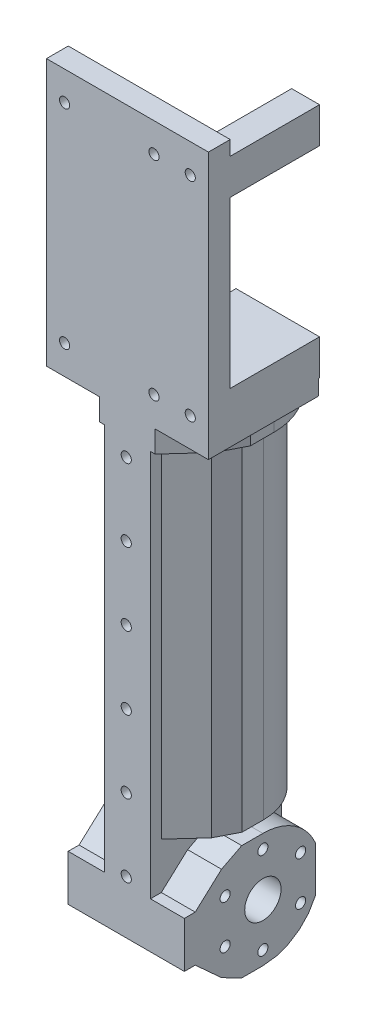
from build123d import *

# Parameters (mm, degrees)
ESQUISSE1_W                  = 22.3
ESQUISSE1_H                  = 36.68
ESQUISSE1_R                  = 0.7
BOSS_EXTRU_1_DEPTH           = 3
ESQUISSE2_W                  = 11.5
ESQUISSE2_H                  = 4.9
BOSS_EXTRU_2_DEPTH           = 12.3
ESQUISSE3_R                  = 0.7
ENL_V_MAT_EXTRU_1_DEPTH      = 46.571947512
BOSS_EXTRU_3_DEPTH           = 2.1
BOSS_EXTRU_4_DEPTH           = 3
BOSS_EXTRU_5_DEPTH           = 47
ESQUISSE9_W                  = 6.330208048
ESQUISSE9_H                  = 18.044681103
BOSS_EXTRU_6_DEPTH           = 19
BOSS_EXTRU_7_DEPTH           = 5
BOSS_EXTRU_7_DEPTH_BACK      = 11
ENL_V_MAT_EXTRU_3_DEPTH      = 73.539666527
ENL_V_MAT_EXTRU_3_DEPTH_BACK = 73.539666527
ESQUISSE13_R                 = 0.7
ENL_V_MAT_EXTRU_4_DEPTH      = 10
ESQUISSE15_R                 = 2.5
ESQUISSE15_R_2               = 0.7
ENL_V_MAT_EXTRU_5_DEPTH      = 73.212855517
ESQUISSE16_W                 = 11.5
ESQUISSE16_H                 = 4.9
BOSS_EXTRU_8_DEPTH           = 12.3
ESQUISSE17_R                 = 0.7
ENL_V_MAT_EXTRU_6_DEPTH      = 74.831939482
ESQUISSE18_W                 = 7.663831116
ESQUISSE18_H                 = 11.431085426
ENL_V_MAT_EXTRU_7_DEPTH      = 6.3


with BuildPart() as part:
    # Esquisse1 → Boss.-Extru.1 (new body)
    with BuildSketch(Plane.XY):
        with Locations((11.15, 18.34)):
            Rectangle(ESQUISSE1_W, ESQUISSE1_H)
        with Locations((19.8, 32.68)):
            Circle(ESQUISSE1_R, mode=Mode.SUBTRACT)
        with Locations(Location((2.5, 32.68, 0), (0, 0, 180))):
            Circle(ESQUISSE1_R, mode=Mode.SUBTRACT)
        with Locations((2.5, 4)):
            Circle(ESQUISSE1_R, mode=Mode.SUBTRACT)
        with Locations(Location((19.8, 4, 0), (0, 0, 180))):
            Circle(ESQUISSE1_R, mode=Mode.SUBTRACT)
        with Locations((14.8, 32.68)):
            Circle(ESQUISSE1_R, mode=Mode.SUBTRACT)
        with Locations(Location((14.8, 4, 0), (0, 0, 180))):
            Circle(ESQUISSE1_R, mode=Mode.SUBTRACT)
    extrude(amount=BOSS_EXTRU_1_DEPTH)

    # Esquisse2 → Boss.-Extru.2 (add)
    with BuildSketch(Plane(origin=(0, 0, 0), x_dir=(-1, 0, 0), z_dir=(0, 0, -1))):
        with Locations((-16.55, 4.55)):
            Rectangle(ESQUISSE2_W, ESQUISSE2_H)
    extrude(amount=BOSS_EXTRU_2_DEPTH)

    # Esquisse3 → Enlèv. mat.-Extru.1 (cut, through all)
    with BuildSketch(Plane.XY.offset(3)):
        with Locations((14.8, 32.68)):
            Circle(ESQUISSE3_R)
        with Locations((19.8, 32.68)):
            Circle(ESQUISSE3_R)
        with Locations(Location((14.8, 4, 0), (0, 0, 180))):
            Circle(ESQUISSE3_R)
        with Locations(Location((19.8, 4, 0), (0, 0, 180))):
            Circle(ESQUISSE3_R)
    extrude(amount=-ENL_V_MAT_EXTRU_1_DEPTH, mode=Mode.SUBTRACT)

    # Esquisse4 → Boss.-Extru.3 (add)
    with BuildSketch(Plane.XZ.offset(-2.1)):
        Polygon((22.3, 0), (10.844911365, 0), (22.3, -12.182112526), align=None)
    extrude(amount=BOSS_EXTRU_3_DEPTH)

    # Esquisse6 → Boss.-Extru.4 (add)
    with BuildSketch(Plane.XZ):
        with BuildLine():
            Line((14.977510411, 3), (7.322489589, 3))
            Line((7.322489589, 3), (3.441219786, -1.258424259))
            Line((3.441219786, -1.258424259), (1.756159604, -4.536943828))
            Line((1.756159604, -4.536943828), (1.756159604, -7.813164477))
            ThreePointArc((1.756159604, -7.813164477), (11.15, -17.207004873), (20.543840396, -7.813164477))
            Line((20.543840396, -7.813164477), (20.543840396, -4.536943828))
            Line((20.543840396, -4.536943828), (18.858780214, -1.258424259))
            Line((18.858780214, -1.258424259), (14.977510411, 3))
        make_face()
    extrude(amount=BOSS_EXTRU_4_DEPTH)

    # Esquisse8 → Boss.-Extru.5 (add)
    with BuildSketch(Plane.XZ.offset(3)):
        with BuildLine():
            Line((7.984895976, 1.5), (4.684165618, -2.12147208))
            Line((4.684165618, -2.12147208), (3.256159604, -4.89985692))
            Line((3.256159604, -4.89985692), (3.256159604, -7.813164477))
            ThreePointArc((3.256159604, -7.813164477), (11.15, -15.707004873), (19.043840396, -7.813164477))
            Line((19.043840396, -7.813164477), (19.043840396, -4.89985692))
            Line((19.043840396, -4.89985692), (17.615834382, -2.12147208))
            Line((17.615834382, -2.12147208), (14.315104024, 1.5))
            Line((14.315104024, 1.5), (14.315104024, 3))
            Line((14.315104024, 3), (7.984895976, 3))
            Line((7.984895976, 3), (7.984895976, 1.5))
        make_face()
    extrude(amount=BOSS_EXTRU_5_DEPTH)

    # Esquisse9 → Boss.-Extru.6 (add)
    with BuildSketch(Plane.XZ.offset(50)):
        with Locations((11.15, -6.022340552)):
            Rectangle(ESQUISSE9_W, ESQUISSE9_H)
    extrude(amount=BOSS_EXTRU_6_DEPTH)

    # Esquisse10 → Boss.-Extru.7 (add, two sides: drawn at the far end of the back side and taken through both)
    with BuildSketch(Plane.ZY.offset(-7.984895976).offset(-BOSS_EXTRU_7_DEPTH_BACK)):
        with BuildLine():
            Line((3, -62.691900244), (3, -56.361692197))
            Line((3, -56.361692197), (1.5, -56.361692197))
            Line((1.5, -56.361692197), (-2.12147208, -53.060961839))
            Line((-2.12147208, -53.060961839), (-4.89985692, -51.632955825))
            Line((-4.89985692, -51.632955825), (-7.813164477, -51.632955825))
            ThreePointArc((-7.813164477, -51.632955825), (-12.133343304, -52.92007456), (-15.044681103, -56.361692197))
            Line((-15.044681103, -56.361692197), (-15.044681103, -62.691900244))
            ThreePointArc((-15.044681103, -62.691900244), (-12.133343304, -66.133517881), (-7.813164477, -67.420636616))
            Line((-7.813164477, -67.420636616), (-4.89985692, -67.420636616))
            Line((-4.89985692, -67.420636616), (-2.12147208, -65.992630602))
            Line((-2.12147208, -65.992630602), (1.5, -62.691900244))
            Line((1.5, -62.691900244), (3, -62.691900244))
        make_face()
    extrude(amount=BOSS_EXTRU_7_DEPTH + BOSS_EXTRU_7_DEPTH_BACK)

    # Esquisse12 → Enlèv. mat.-Extru.3 (cut, two sides: drawn at the far end of the back side and taken through both)
    with BuildSketch(Plane.ZY.offset(-7.984895976).offset(-ENL_V_MAT_EXTRU_3_DEPTH_BACK)):
        Polygon((-15.044681103, -62.691900244), (-15.044681103, -69), (3, -69), (3, -62.691900244), (1.5, -62.691900244), (-2.12147208, -65.992630602), (-4.89985692, -67.420636616), (-7.813164477, -67.420636616), (-9.686348115, -67.195166272), (-11.232319732, -66.641716708), (-12.800489495, -65.645562875), (-14.068080348, -64.342265423), align=None)
    extrude(amount=ENL_V_MAT_EXTRU_3_DEPTH + ENL_V_MAT_EXTRU_3_DEPTH_BACK, mode=Mode.SUBTRACT)

    # Esquisse13 → Enlèv. mat.-Extru.4 (cut)
    with BuildSketch(Plane.XY.offset(3)):
        with Locations((10.984895976, -5.369741895)):
            Circle(ESQUISSE13_R)
        with Locations((10.984895976, -15.369741895)):
            Circle(ESQUISSE13_R)
        with Locations((10.984895976, -25.369741895)):
            Circle(ESQUISSE13_R)
        with Locations((10.984895976, -35.369741895)):
            Circle(ESQUISSE13_R)
        with Locations((10.984895976, -45.369741895)):
            Circle(ESQUISSE13_R)
        with Locations((10.984895976, -55.369741895)):
            Circle(ESQUISSE13_R)
    extrude(amount=-ENL_V_MAT_EXTRU_4_DEPTH, mode=Mode.SUBTRACT)

    # Esquisse15 → Enlèv. mat.-Extru.5 (cut, through all)
    with BuildSketch(Plane.ZY.offset(-2.984895976)):
        with Locations((-7.813164477, -59.526796221)):
            Circle(ESQUISSE15_R)
        with Locations((-7.813164477, -53.526796221)):
            Circle(ESQUISSE15_R_2)
        with Locations((-2.617012055, -56.526796221)):
            Circle(ESQUISSE15_R_2)
        with Locations((-2.617012055, -62.526796221)):
            Circle(ESQUISSE15_R_2)
        with Locations((-7.813164477, -65.526796221)):
            Circle(ESQUISSE15_R_2)
        with Locations((-13.0093169, -62.526796221)):
            Circle(ESQUISSE15_R_2)
        with Locations((-13.0093169, -56.526796221)):
            Circle(ESQUISSE15_R_2)
    extrude(amount=-ENL_V_MAT_EXTRU_5_DEPTH, mode=Mode.SUBTRACT)

    # Esquisse16 → Boss.-Extru.8 (add)
    with BuildSketch(Plane(origin=(0, 0, 0), x_dir=(-1, 0, 0), z_dir=(0, 0, -1))):
        with Locations((-16.55, 32.23)):
            Rectangle(ESQUISSE16_W, ESQUISSE16_H)
    extrude(amount=BOSS_EXTRU_8_DEPTH)

    # Esquisse17 → Enlèv. mat.-Extru.6 (cut, through all)
    with BuildSketch(Plane.XY.offset(3)):
        with Locations(Location((14.8, 32.68, 0), (0, 0, 180))):
            Circle(ESQUISSE17_R)
        with Locations(Location((19.8, 32.68, 0), (0, 0, 180))):
            Circle(ESQUISSE17_R)
    extrude(amount=-ENL_V_MAT_EXTRU_6_DEPTH, mode=Mode.SUBTRACT)

    # Esquisse18 → Enlèv. mat.-Extru.7 (cut)
    with BuildSketch(Plane(origin=(0, 34.68, 0), x_dir=(1, 0, 0), z_dir=(0, 1, 0))):
        with Locations((14.631915558, 6.584457287)):
            Rectangle(ESQUISSE18_W, ESQUISSE18_H)
    extrude(amount=-ENL_V_MAT_EXTRU_7_DEPTH, mode=Mode.SUBTRACT)


solid = part.part
